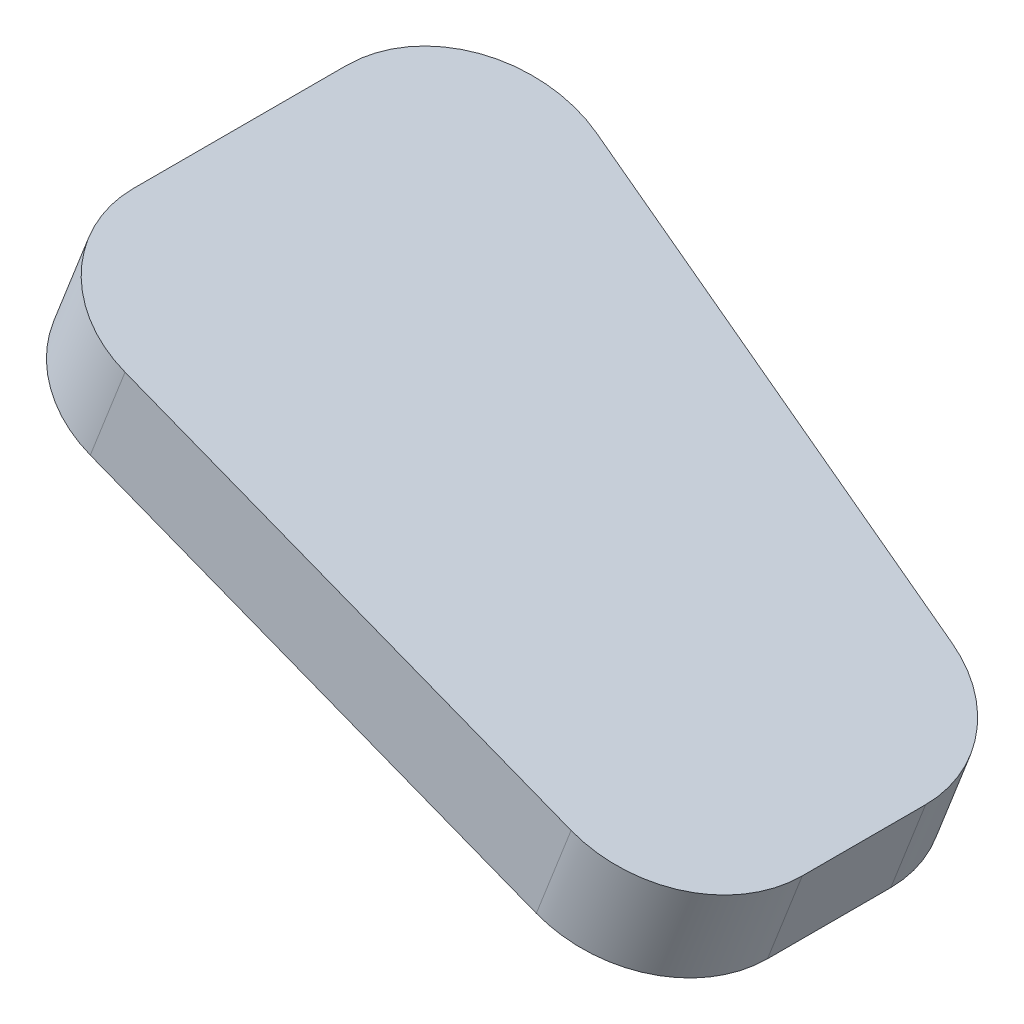
from build123d import *

# Parameters (mm, degrees)
BOSS_EXTRUDE1_DEPTH = 2.54


with BuildPart() as part:
    # Sketch1 → Boss-Extrude1 (new body)
    with BuildSketch(Plane(origin=(-4.89903509, -12.573036438, 0), x_dir=(0.9317661243126444, -0.3630590717547129, 0), z_dir=(0.36305907175471297, 0.9317661243126445, 0))):
        with BuildLine():
            Line((-39.473318488, -28.415842411), (-26.773318488, -28.415842411))
            ThreePointArc((-26.773318488, -28.415842411), (-24.528254458, -27.485906441), (-23.598318488, -25.240842411))
            Line((-23.598318488, -25.240842411), (-23.598318488, -21.96910475))
            ThreePointArc((-23.598318488, -21.96910475), (-24.329042729, -19.94274323), (-26.184864007, -18.849113352))
            Line((-26.184864007, -18.849113352), (-38.884864007, -16.453795235))
            ThreePointArc((-38.884864007, -16.453795235), (-41.499680008, -17.129510873), (-42.648318488, -19.573786633))
            Line((-42.648318488, -19.573786633), (-42.648318488, -25.240842411))
            ThreePointArc((-42.648318488, -25.240842411), (-41.718382519, -27.485906441), (-39.473318488, -28.415842411))
        make_face()
    extrude(amount=BOSS_EXTRUDE1_DEPTH)


solid = part.part
